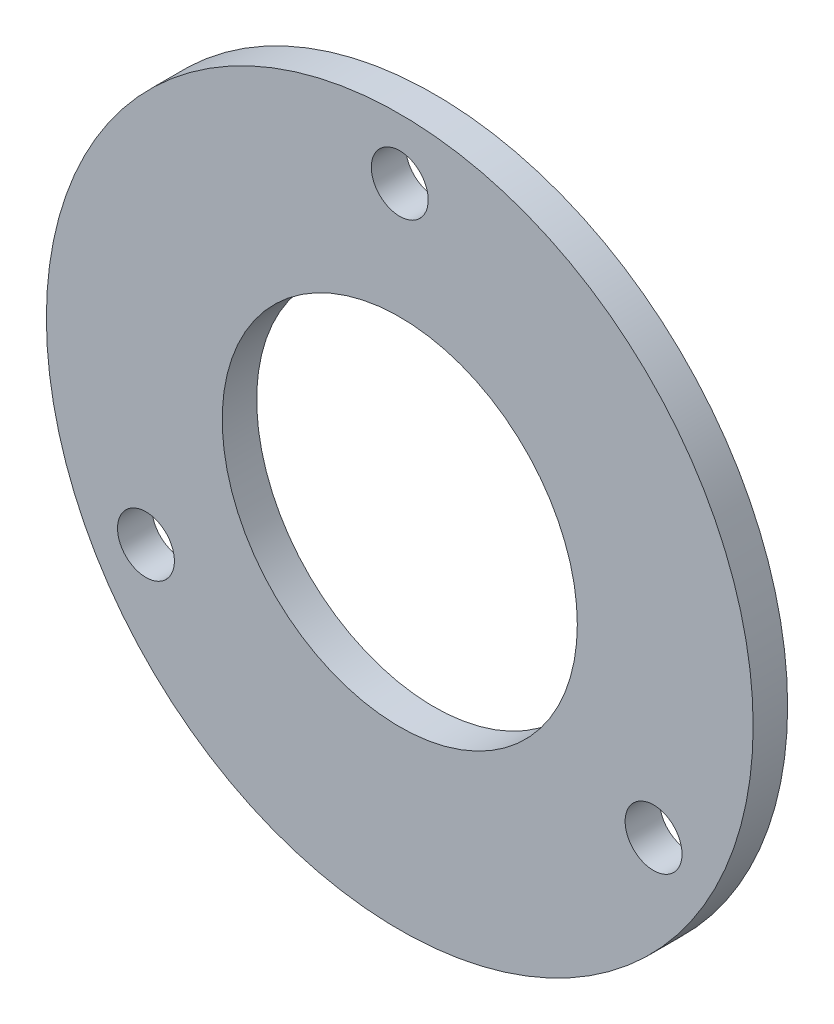
from build123d import *

# Parameters (mm, degrees)
PROFILE_1_R               = 20.5
PROFILE_1_R_2             = 10.3
PROFILE_1_R_3             = 1.65
OUTER_RACE_RETAINER_DEPTH = 2


with BuildPart() as part:
    # Profile_1 → Outer_race_retainer (new body)
    with BuildSketch(Plane.XY):
        Circle(PROFILE_1_R)
        Circle(PROFILE_1_R_2, mode=Mode.SUBTRACT)
        with Locations((0, 17)):
            Circle(PROFILE_1_R_3, mode=Mode.SUBTRACT)
        with Locations((-14.722431864, -8.5)):
            Circle(PROFILE_1_R_3, mode=Mode.SUBTRACT)
        with Locations((14.722431864, -8.5)):
            Circle(PROFILE_1_R_3, mode=Mode.SUBTRACT)
    extrude(amount=OUTER_RACE_RETAINER_DEPTH)


solid = part.part
